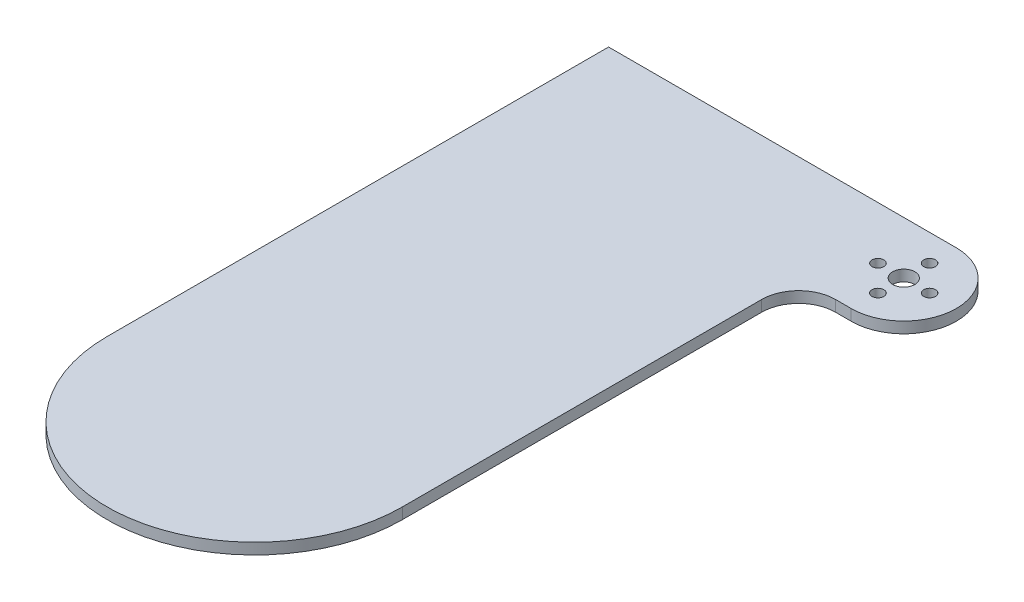
from build123d import *

# Parameters (mm, degrees)
SKETCH_1_R              = 3
EXTRUDE_1_DEPTH         = 3
HOLE_WIZARD_3_2_3_2_1_D = 3.2


with BuildPart() as part:
    # 草图1 → 凸台-拉伸1 (new body)
    with BuildSketch(Plane(origin=(0, 0, 0), x_dir=(1, 0, 0), z_dir=(0, 1, 0))):
        with BuildLine():
            Line((-55.525082752, -48.428156032), (-55.525082752, 87.471843968))
            Line((-55.525082752, 87.471843968), (38.724917248, 87.471843968))
            ThreePointArc((38.724917248, 87.471843968), (52.974917248, 73.221843968), (38.724917248, 58.971843968))
            Line((38.724917248, 58.971843968), (34.474917248, 58.971843968))
            ThreePointArc((34.474917248, 58.971843968), (27.403849436, 56.04291178), (24.474917248, 48.971843968))
            Line((24.474917248, 48.971843968), (24.474917248, -48.428156032))
            ThreePointArc((24.474917248, -48.428156032), (-15.525082752, -88.428156032), (-55.525082752, -48.428156032))
        make_face()
        with Locations(Location((38.724917248, 73.221843968, 0), (0, 0, 270))):
            Circle(SKETCH_1_R, mode=Mode.SUBTRACT)
    extrude(amount=EXTRUDE_1_DEPTH)

    # Ø3.2 (3.2) 直径孔1 (through all)
    with Locations(Plane(origin=(38.724917248, 3, -80.221843968), x_dir=(0, 0, 1), z_dir=(0, 1, 0))):
        with Locations((0, 0), (7, -7), (14, 0), (7, 7)):
            Hole(HOLE_WIZARD_3_2_3_2_1_D / 2)


solid = part.part
